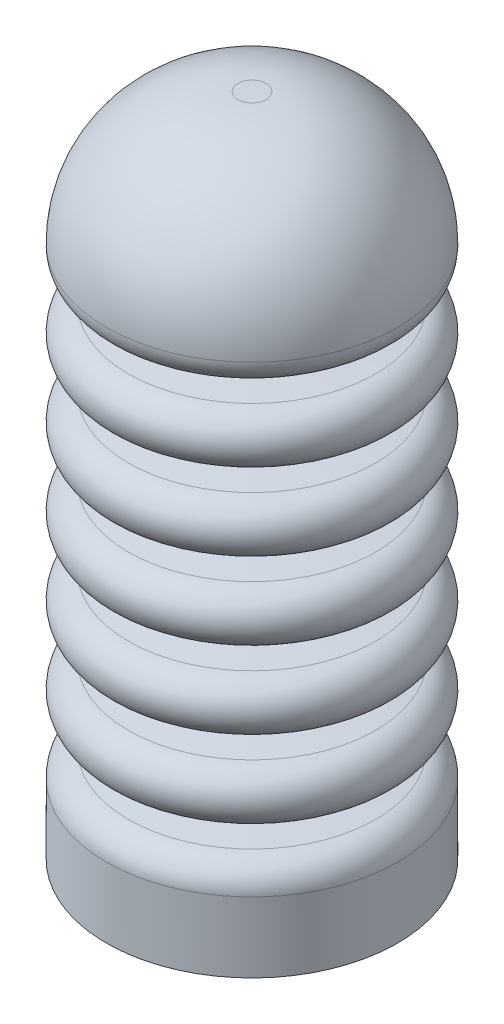
from build123d import *

# Parameters (mm, degrees)
SKETCH2_R           = 20.750019809
BOSS_EXTRUDE1_DEPTH = 10


with BuildPart() as part:
    # Sketch1 → Revolve2 (revolve)
    with BuildSketch(Plane(origin=(0, 0, 0), x_dir=(0, 0, -1), z_dir=(1, 0, 0))):
        with BuildLine():
            Line((-9.616751909, 62.551085638), (-3.251663234, 61.489785283))
            ThreePointArc((-3.251663234, 61.489785283), (-2.625013615, 60.749995786), (-3.251668322, 60.010210599))
            Line((-3.251668322, 60.010210599), (-9.616767827, 58.948953436))
            ThreePointArc((-9.616767827, 58.948953436), (-12.75001785, 55.250030043), (-9.616764802, 51.551086511))
            Line((-9.616764802, 51.551086511), (-3.251664068, 50.489785422))
            ThreePointArc((-3.251664068, 50.489785422), (-2.625013615, 49.749996092), (-3.251668552, 49.010210561))
            Line((-3.251668552, 49.010210561), (-9.616745174, 47.948959247))
            ThreePointArc((-9.616745174, 47.948959247), (-12.750019856, 44.250032756), (-9.616769893, 40.551085326))
            Line((-9.616769893, 40.551085326), (-3.251664068, 39.489785422))
            ThreePointArc((-3.251664068, 39.489785422), (-2.625013615, 38.749996092), (-3.251668552, 38.010210561))
            Line((-3.251668552, 38.010210561), (-9.616745174, 36.948959247))
            ThreePointArc((-9.616745174, 36.948959247), (-12.750019856, 33.250032756), (-9.616769893, 29.551085326))
            Line((-9.616769893, 29.551085326), (-3.251663378, 28.489785307))
            ThreePointArc((-3.251663378, 28.489785307), (-2.625013615, 27.749995743), (-3.251668552, 27.010210561))
            Line((-3.251668552, 27.010210561), (-9.616745174, 25.948959247))
            ThreePointArc((-9.616745174, 25.948959247), (-12.750019856, 22.250032756), (-9.616769893, 18.551085326))
            Line((-9.616769893, 18.551085326), (-3.251663378, 17.489785307))
            ThreePointArc((-3.251663378, 17.489785307), (-2.625013615, 16.749995859), (-3.251668322, 16.010210599))
            Line((-3.251668322, 16.010210599), (-9.616745994, 14.948957076))
            ThreePointArc((-9.616745994, 14.948957076), (-12.75001785, 11.250032756), (-9.616770713, 7.551087497))
            Line((-9.616770713, 7.551087497), (-3.251663378, 6.489785307))
            ThreePointArc((-3.251663378, 6.489785307), (-2.625013615, 5.749995745), (-3.251668547, 5.010210562))
            Line((-3.251668547, 5.010210562), (-9.616754998, 3.948957561))
            ThreePointArc((-9.616754998, 3.948957561), (-11.861416619, 2.673841221), (-12.750019809, 0.250020225))
            Line((-12.750019809, 0.250020225), (-10.775764722, 0.250020225))
            ThreePointArc((-10.775764722, 0.250020225), (-10.351864543, 1.401447936), (-9.282548216, 2.003145308))
            Line((-9.282548216, 2.003145308), (-2.933588419, 3.035657967))
            ThreePointArc((-2.933588419, 3.035657967), (-0.625013615, 5.749989143), (-2.933570213, 8.464335802))
            Line((-2.933570213, 8.464335802), (-9.282554456, 9.496896148))
            ThreePointArc((-9.282554456, 9.496896148), (-10.775764722, 11.250020225), (-9.282554456, 13.003144302))
            Line((-9.282554456, 13.003144302), (-2.933588423, 14.035657967))
            ThreePointArc((-2.933588423, 14.035657967), (-0.625013615, 16.749989141), (-2.933570213, 19.464335802))
            Line((-2.933570213, 19.464335802), (-9.282554457, 20.496896149))
            ThreePointArc((-9.282554457, 20.496896149), (-10.775764722, 22.250020225), (-9.282554457, 24.003144302))
            Line((-9.282554457, 24.003144302), (-2.933588423, 25.035657967))
            ThreePointArc((-2.933588423, 25.035657967), (-0.625013615, 27.749989141), (-2.933570213, 30.464335802))
            Line((-2.933570213, 30.464335802), (-9.282554457, 31.496896149))
            ThreePointArc((-9.282554457, 31.496896149), (-10.775764722, 33.250020225), (-9.282554458, 35.003144302))
            Line((-9.282554458, 35.003144302), (-2.933588423, 36.035657967))
            ThreePointArc((-2.933588423, 36.035657967), (-0.625019121, 38.744495593), (-2.922729146, 41.46255044))
            Line((-2.922729146, 41.46255044), (-9.267799008, 42.414069793))
            ThreePointArc((-9.267799008, 42.414069793), (-10.855395735, 44.250136624), (-9.267568646, 46.086004242))
            Line((-9.267568646, 46.086004242), (-2.967353693, 47.030381961))
            ThreePointArc((-2.967353693, 47.030381961), (-0.625041747, 49.737559588), (-2.942767932, 52.465815677))
            Line((-2.942767932, 52.465815677), (-9.28255392, 53.474847144))
            ThreePointArc((-9.28255392, 53.474847144), (-10.797536189, 55.25002943), (-9.282548222, 57.025194214))
            Line((-9.282548222, 57.025194214), (-2.942786198, 58.034178147))
            ThreePointArc((-2.942786198, 58.034178147), (-0.625032387, 60.739837448), (-2.922728882, 63.462550396))
            Line((-2.922728882, 63.462550396), (-9.287817558, 64.523850751))
            ThreePointArc((-9.287817558, 64.523850751), (-10.335324829, 65.118911212), (-10.75, 66.250022585))
            ThreePointArc((-10.75, 66.250022585), (-5.8440306, 78.09404657), (6, 83))
            Line((6, 83), (8, 83))
            Line((8, 83), (8, 85))
            Line((8, 85), (6, 85))
            ThreePointArc((6, 85), (-7.258252147, 79.508252147), (-12.75, 66.25))
            ThreePointArc((-12.75, 66.25), (-11.86141141, 63.82621645), (-9.616751909, 62.551085638))
        make_face()
    revolve(axis=Axis((0, 83, -8), (0, -1, 0)))

    # Sketch2 → Boss-Extrude1 (add)
    with BuildSketch(Plane.XZ.offset(-0.250020225)):
        with Locations(Location((0, -8, 0), (0, 0, 270))):
            Circle(SKETCH2_R)
    extrude(amount=BOSS_EXTRUDE1_DEPTH)


solid = part.part
